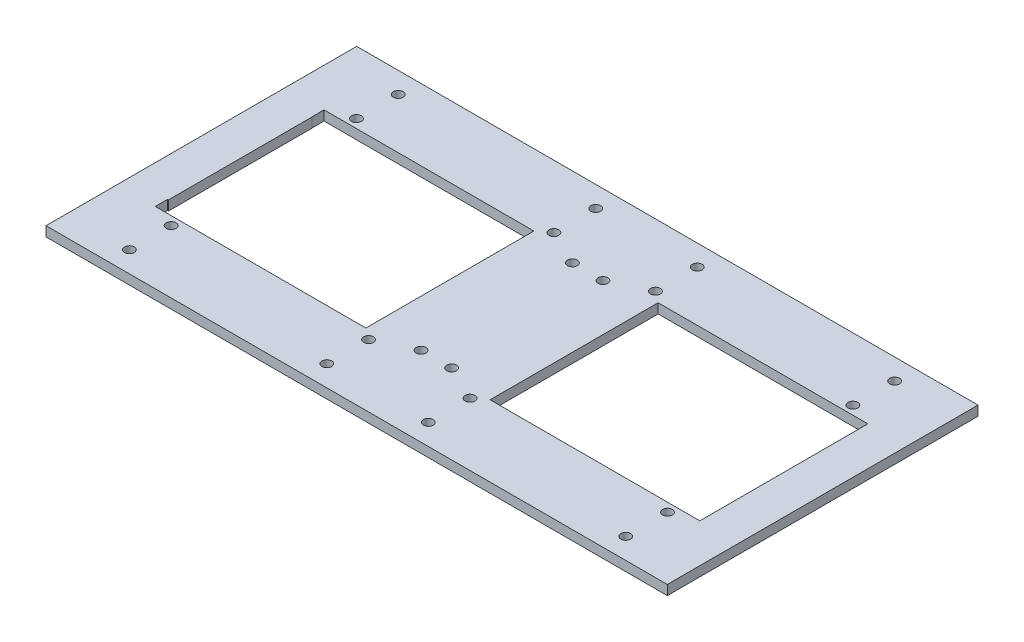
from build123d import *

# Parameters (mm, degrees)
SKETCH1_W           = 203.2
SKETCH1_H           = 101.6
SKETCH1_R           = 1.6
SKETCH1_W_2         = 68.58
SKETCH1_H_2         = 54.953705786
BOSS_EXTRUDE1_DEPTH = 3.175


with BuildPart() as part:
    # Sketch1 → Boss-Extrude1 (new body)
    with BuildSketch(Plane(origin=(0, 0, 0), x_dir=(1, 0, 0), z_dir=(0, 1, 0))):
        with Locations((101.6, -50.8)):
            Rectangle(SKETCH1_W, SKETCH1_H)
        with Locations(Location((20.431013284, -94.769213223, 0), (0, 0, 270))):
            Circle(SKETCH1_R, mode=Mode.SUBTRACT)
        with Locations(Location((20.431013284, -81.10763967, 0), (0, 0, 270))):
            Circle(SKETCH1_R, mode=Mode.SUBTRACT)
        with Locations(Location((85, -94.769213223, 0), (0, 0, 270))):
            Circle(SKETCH1_R, mode=Mode.SUBTRACT)
        with Locations(Location((85, -81.10763967, 0), (0, 0, 270))):
            Circle(SKETCH1_R, mode=Mode.SUBTRACT)
        with Locations(Location((96.6, -75.55, 0), (0, 0, 270))):
            Circle(SKETCH1_R, mode=Mode.SUBTRACT)
        Polygon((12.405089541, -78.276852893), (12.405089541, -74.276852893), (12.7, -74.276852893), (12.7, -27.323147107), (12.648382796, -27.323147107), (12.648382796, -23.323147107), (81.28, -23.323147107), (81.28, -78.276852893), align=None, mode=Mode.SUBTRACT)
        with Locations(Location((118.2, -94.769213223, 0), (0, 0, 270))):
            Circle(SKETCH1_R, mode=Mode.SUBTRACT)
        with Locations(Location((118.2, -81.10763967, 0), (0, 0, 270))):
            Circle(SKETCH1_R, mode=Mode.SUBTRACT)
        with Locations(Location((106.6, -75.55, 0), (0, 0, 270))):
            Circle(SKETCH1_R, mode=Mode.SUBTRACT)
        with Locations(Location((182.768986716, -94.769213223, 0), (0, 0, 270))):
            Circle(SKETCH1_R, mode=Mode.SUBTRACT)
        with Locations(Location((182.768986716, -81.10763967, 0), (0, 0, 270))):
            Circle(SKETCH1_R, mode=Mode.SUBTRACT)
        with Locations((156.21, -50.8)):
            Rectangle(SKETCH1_W_2, SKETCH1_H_2, mode=Mode.SUBTRACT)
        with Locations(Location((20.431013284, -20.49236033, 0), (0, 0, 270))):
            Circle(SKETCH1_R, mode=Mode.SUBTRACT)
        with Locations(Location((20.431013284, -6.830786777, 0), (0, 0, 270))):
            Circle(SKETCH1_R, mode=Mode.SUBTRACT)
        with Locations(Location((96.6, -26.05, 0), (0, 0, 270))):
            Circle(SKETCH1_R, mode=Mode.SUBTRACT)
        with Locations(Location((85, -20.49236033, 0), (0, 0, 270))):
            Circle(SKETCH1_R, mode=Mode.SUBTRACT)
        with Locations(Location((85, -6.830786777, 0), (0, 0, 270))):
            Circle(SKETCH1_R, mode=Mode.SUBTRACT)
        with Locations(Location((106.6, -26.05, 0), (0, 0, 270))):
            Circle(SKETCH1_R, mode=Mode.SUBTRACT)
        with Locations(Location((118.2, -20.49236033, 0), (0, 0, 270))):
            Circle(SKETCH1_R, mode=Mode.SUBTRACT)
        with Locations(Location((118.2, -6.830786777, 0), (0, 0, 270))):
            Circle(SKETCH1_R, mode=Mode.SUBTRACT)
        with Locations(Location((182.768986716, -20.49236033, 0), (0, 0, 270))):
            Circle(SKETCH1_R, mode=Mode.SUBTRACT)
        with Locations(Location((182.768986716, -6.830786777, 0), (0, 0, 270))):
            Circle(SKETCH1_R, mode=Mode.SUBTRACT)
    extrude(amount=-BOSS_EXTRUDE1_DEPTH)


solid = part.part
